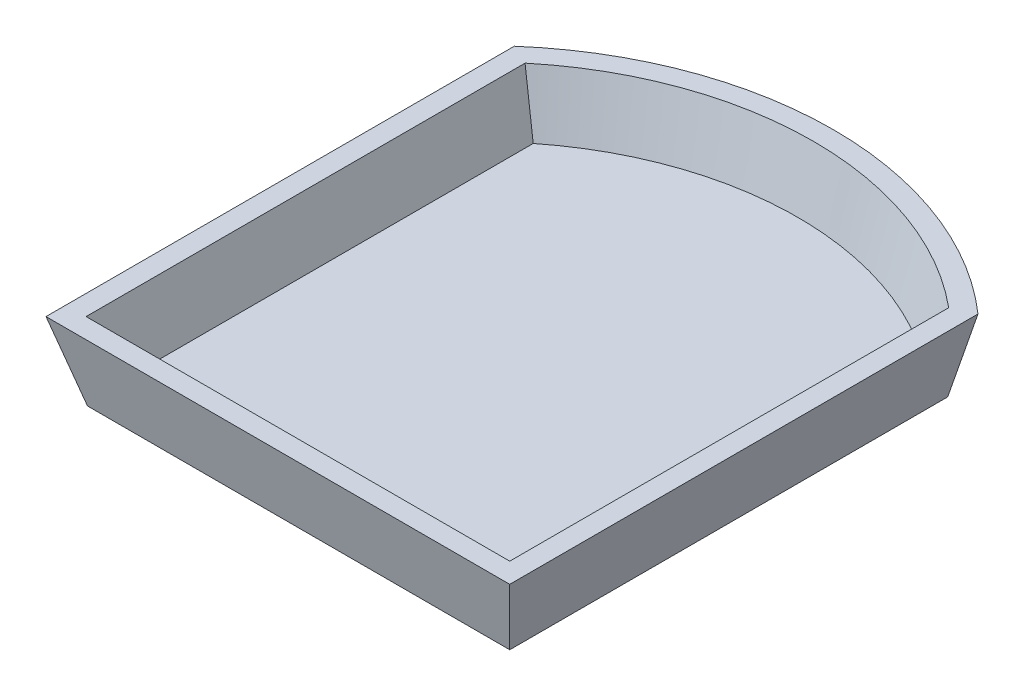
from build123d import *

# Parameters (mm, degrees)
BOSS_EXTRUDE1_DEPTH = 40
BOSS_EXTRUDE1_DRAFT = -15
SHELL1_T            = -10


with BuildPart() as part:
    # Sketch1 → Boss-Extrude1 (with draft: the straight prism first)
    with BuildSketch(Plane(origin=(0, 0, 0), x_dir=(1, 0, 0), z_dir=(0, 1, 0))):
        with BuildLine():
            Line((-109.029856613, -113.081906669), (109.029856613, -113.081906669))
            Line((109.029856613, -113.081906669), (109.029856613, 113.081906669))
            ThreePointArc((109.029856613, 113.081906669), (0, 152.401411753), (-109.029856613, 113.081906669))
            Line((-109.029856613, 113.081906669), (-109.029856613, -113.081906669))
        make_face()
    extrude(amount=BOSS_EXTRUDE1_DEPTH)
    # Boss-Extrude1: the draft: its side faces are tilted about the plane it starts from
    boss_extrude1_sides = [part.faces().sort_by_distance(p)[0] for p in [
        (0, 20, 113.081906669),
        (109.029856613, 20, 0),
        (0, 20, -152.401411753),
        (-109.029856613, 20, 0),
    ]]
    draft(boss_extrude1_sides, Plane(origin=(0, 0, 0), x_dir=(1, 0, 0), z_dir=(0, 1, 0)), BOSS_EXTRUDE1_DRAFT)

    # Shell1
    shell1_openings = [part.faces().sort_by_distance(p)[0] for p in [
        (0, 40, -12.878837242),
    ]]
    offset(amount=SHELL1_T, openings=shell1_openings, kind=Kind.INTERSECTION)


solid = part.part
